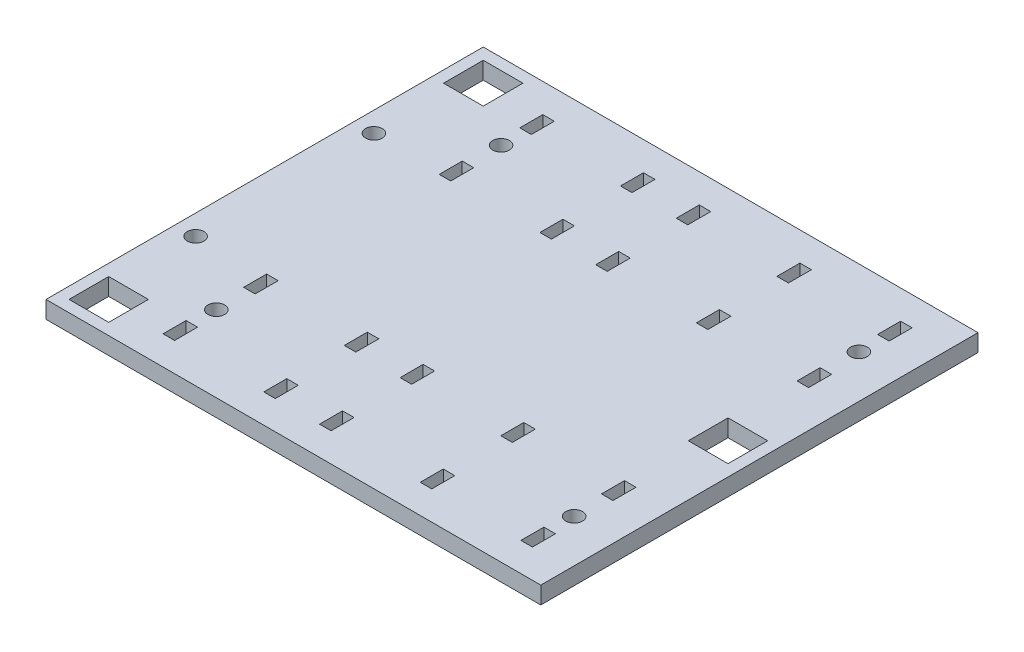
from build123d import *

# Parameters (mm, degrees)
ESQUISSE1_W        = 86
ESQUISSE1_H        = 76
ESQUISSE1_R        = 1.45
ESQUISSE1_W_2      = 2
ESQUISSE1_H_2      = 4
ESQUISSE1_W_3      = 6.9
ESQUISSE1_H_3      = 6.9
BOSS_EXTRU_1_DEPTH = 3


with BuildPart() as part:
    # Esquisse1 → Boss.-Extru.1 (new body)
    with BuildSketch(Plane(origin=(0, 0, 0), x_dir=(1, 0, 0), z_dir=(0, 1, 0))):
        with Locations((43, 38)):
            Rectangle(ESQUISSE1_W, ESQUISSE1_H)
        with Locations(Location((16.35, 13.25, 0), (0, 0, 270))):
            Circle(ESQUISSE1_R, mode=Mode.SUBTRACT)
        with Locations(Location((78.55, 13.25, 0), (0, 0, 270))):
            Circle(ESQUISSE1_R, mode=Mode.SUBTRACT)
        with Locations(Location((78.55, 62.75, 0), (0, 0, 90))):
            Circle(ESQUISSE1_R, mode=Mode.SUBTRACT)
        with Locations(Location((16.35, 62.75, 0), (0, 0, 90))):
            Circle(ESQUISSE1_R, mode=Mode.SUBTRACT)
        with Locations(Location((3.5, 22.5, 0), (0, 0, 270))):
            Circle(ESQUISSE1_R, mode=Mode.SUBTRACT)
        with Locations(Location((3.5, 53.5, 0), (0, 0, 90))):
            Circle(ESQUISSE1_R, mode=Mode.SUBTRACT)
        with Locations((61.05, 7)):
            Rectangle(ESQUISSE1_W_2, ESQUISSE1_H_2, mode=Mode.SUBTRACT)
        with Locations((16.35, 7)):
            Rectangle(ESQUISSE1_W_2, ESQUISSE1_H_2, mode=Mode.SUBTRACT)
        with Locations((80.55, 38)):
            Rectangle(ESQUISSE1_W_3, ESQUISSE1_H_3, mode=Mode.SUBTRACT)
        with Locations((33.85, 7)):
            Rectangle(ESQUISSE1_W_2, ESQUISSE1_H_2, mode=Mode.SUBTRACT)
        with Locations((5.45, 5.45)):
            Rectangle(ESQUISSE1_W_3, ESQUISSE1_H_3, mode=Mode.SUBTRACT)
        with Locations((33.85, 21)):
            Rectangle(ESQUISSE1_W_2, ESQUISSE1_H_2, mode=Mode.SUBTRACT)
        with Locations((16.35, 21)):
            Rectangle(ESQUISSE1_W_2, ESQUISSE1_H_2, mode=Mode.SUBTRACT)
        with Locations((78.55, 7)):
            Rectangle(ESQUISSE1_W_2, ESQUISSE1_H_2, mode=Mode.SUBTRACT)
        with Locations((78.55, 21)):
            Rectangle(ESQUISSE1_W_2, ESQUISSE1_H_2, mode=Mode.SUBTRACT)
        with Locations((61.05, 21)):
            Rectangle(ESQUISSE1_W_2, ESQUISSE1_H_2, mode=Mode.SUBTRACT)
        with Locations((61.05, 55)):
            Rectangle(ESQUISSE1_W_2, ESQUISSE1_H_2, mode=Mode.SUBTRACT)
        with Locations((78.55, 55)):
            Rectangle(ESQUISSE1_W_2, ESQUISSE1_H_2, mode=Mode.SUBTRACT)
        with Locations((78.55, 69)):
            Rectangle(ESQUISSE1_W_2, ESQUISSE1_H_2, mode=Mode.SUBTRACT)
        with Locations((16.35, 55)):
            Rectangle(ESQUISSE1_W_2, ESQUISSE1_H_2, mode=Mode.SUBTRACT)
        with Locations((33.85, 55)):
            Rectangle(ESQUISSE1_W_2, ESQUISSE1_H_2, mode=Mode.SUBTRACT)
        with Locations((33.85, 69)):
            Rectangle(ESQUISSE1_W_2, ESQUISSE1_H_2, mode=Mode.SUBTRACT)
        with Locations((5.45, 70.55)):
            Rectangle(ESQUISSE1_W_3, ESQUISSE1_H_3, mode=Mode.SUBTRACT)
        with Locations((61.05, 69)):
            Rectangle(ESQUISSE1_W_2, ESQUISSE1_H_2, mode=Mode.SUBTRACT)
        with Locations((16.35, 69)):
            Rectangle(ESQUISSE1_W_2, ESQUISSE1_H_2, mode=Mode.SUBTRACT)
        with Locations((43.55, 55)):
            Rectangle(ESQUISSE1_W_2, ESQUISSE1_H_2, mode=Mode.SUBTRACT)
        with Locations((43.55, 7)):
            Rectangle(ESQUISSE1_W_2, ESQUISSE1_H_2, mode=Mode.SUBTRACT)
        with Locations((43.55, 21)):
            Rectangle(ESQUISSE1_W_2, ESQUISSE1_H_2, mode=Mode.SUBTRACT)
        with Locations((43.55, 69)):
            Rectangle(ESQUISSE1_W_2, ESQUISSE1_H_2, mode=Mode.SUBTRACT)
    extrude(amount=BOSS_EXTRU_1_DEPTH)


solid = part.part
